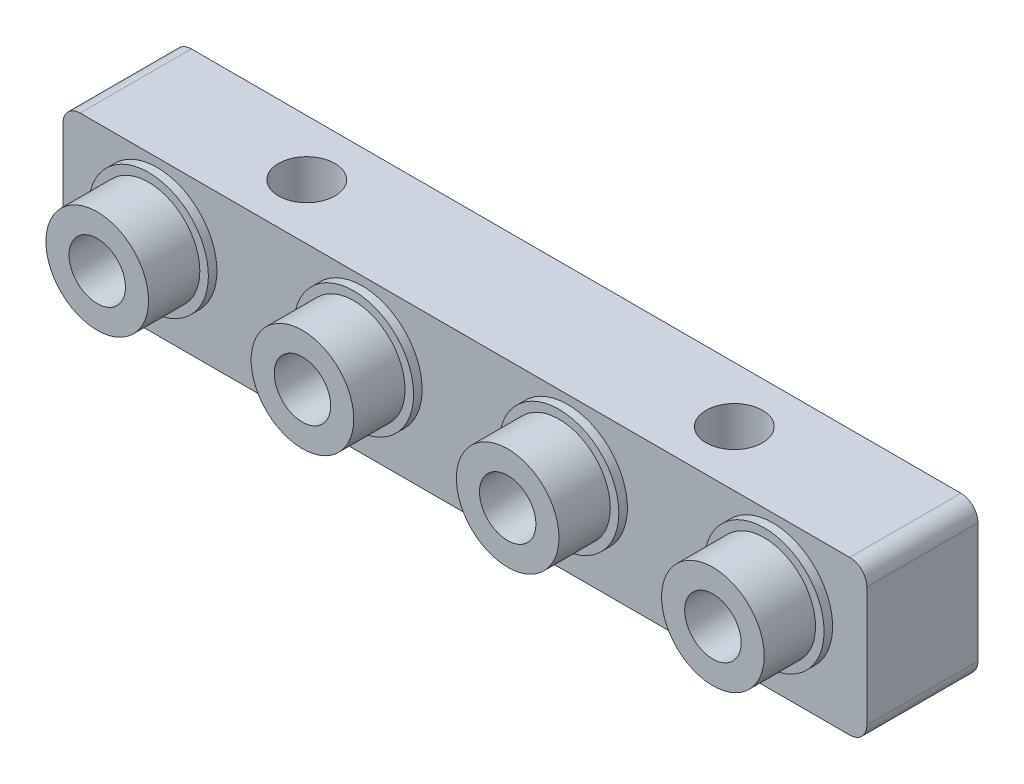
from build123d import *

# Parameters (mm, degrees)
SKETCH_1_W          = 47
SKETCH_1_H          = 9
EXTRUDE_1_DEPTH     = 6.5
SKETCH_2_R          = 3
EXTRUDE_2_DEPTH     = 3.5
SKETCH_3_R          = 3.5
EXTRUDE_3_DEPTH     = 0.5
SKETCH_4_R          = 1.65
CUT_EXTRUDE_1_DEPTH = 10
SKETCH_5_R          = 1.65
CUT_EXTRUDE_2_DEPTH = 9
FILLET_1_R          = 1


with BuildPart() as part:
    # ｽｹｯﾁ1 → ﾎﾞｽ - 押し出し1 (new body)
    with BuildSketch(Plane.XY):
        with Locations((23.5, 4.5)):
            Rectangle(SKETCH_1_W, SKETCH_1_H)
    extrude(amount=EXTRUDE_1_DEPTH)

    # ｽｹｯﾁ2 → ﾎﾞｽ - 押し出し2 (add)
    with BuildSketch(Plane.XY.offset(6.5)):
        with Locations(Location((5.5, 5, 0), (0, 0, 180))):
            Circle(SKETCH_2_R)
        with Locations(Location((17.5, 5, 0), (0, 0, 180))):
            Circle(SKETCH_2_R)
        with Locations(Location((29.5, 5, 0), (0, 0, 180))):
            Circle(SKETCH_2_R)
        with Locations(Location((41.5, 5, 0), (0, 0, 180))):
            Circle(SKETCH_2_R)
    extrude(amount=EXTRUDE_2_DEPTH)

    # ｽｹｯﾁ3 → ﾎﾞｽ - 押し出し3 (add)
    with BuildSketch(Plane.XY.offset(6.5)):
        with Locations(Location((5.5, 5, 0), (0, 0, 180))):
            Circle(SKETCH_3_R)
        with Locations(Location((17.5, 5, 0), (0, 0, 180))):
            Circle(SKETCH_3_R)
        with Locations(Location((29.5, 5, 0), (0, 0, 180))):
            Circle(SKETCH_3_R)
        with Locations(Location((41.5, 5, 0), (0, 0, 180))):
            Circle(SKETCH_3_R)
    extrude(amount=EXTRUDE_3_DEPTH)

    # ｽｹｯﾁ4 → ｶｯﾄ - 押し出し1 (cut)
    with BuildSketch(Plane.XY.offset(10)):
        with Locations((5.5, 5)):
            Circle(SKETCH_4_R)
        with Locations((17.5, 5)):
            Circle(SKETCH_4_R)
        with Locations((29.5, 5)):
            Circle(SKETCH_4_R)
        with Locations((41.5, 5)):
            Circle(SKETCH_4_R)
    extrude(amount=-CUT_EXTRUDE_1_DEPTH, mode=Mode.SUBTRACT)

    # ｽｹｯﾁ5 → ｶｯﾄ - 押し出し2 (cut)
    with BuildSketch(Plane(origin=(0, 9, 0), x_dir=(1, 0, 0), z_dir=(0, 1, 0))):
        with Locations(Location((11, -3.25, 0), (0, 0, 270))):
            Circle(SKETCH_5_R)
        with Locations(Location((36, -3.25, 0), (0, 0, 270))):
            Circle(SKETCH_5_R)
    extrude(amount=-CUT_EXTRUDE_2_DEPTH, mode=Mode.SUBTRACT)

    # ﾌｨﾚｯﾄ1
    fillet_1_edges = [part.edges().sort_by_distance(p)[0] for p in [
        (0, 9, 3.25),
        (47, 9, 3.25),
        (47, 0, 3.25),
        (0, 0, 3.25),
    ]]
    fillet(fillet_1_edges, radius=FILLET_1_R)


solid = part.part
